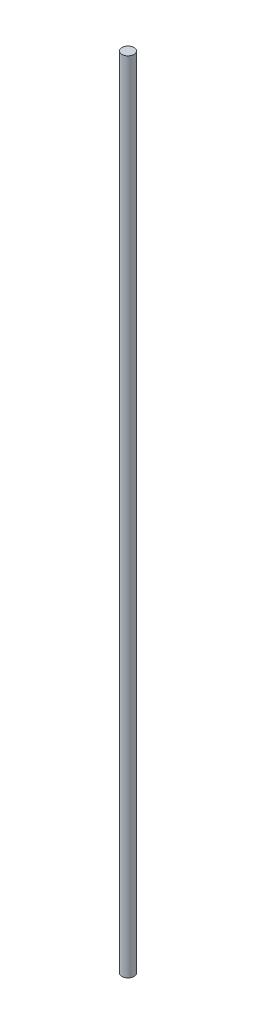
from build123d import *

# Parameters (mm, degrees)
ESQUISSE1_R        = 2.5
BOSS_EXTRU_1_DEPTH = 330.7


with BuildPart() as part:
    # Esquisse1 → Boss.-Extru.1 (new body)
    with BuildSketch(Plane(origin=(0, 0, 0), x_dir=(1, 0, 0), z_dir=(0, 1, 0))):
        Circle(ESQUISSE1_R)
    extrude(amount=BOSS_EXTRU_1_DEPTH)


solid = part.part
